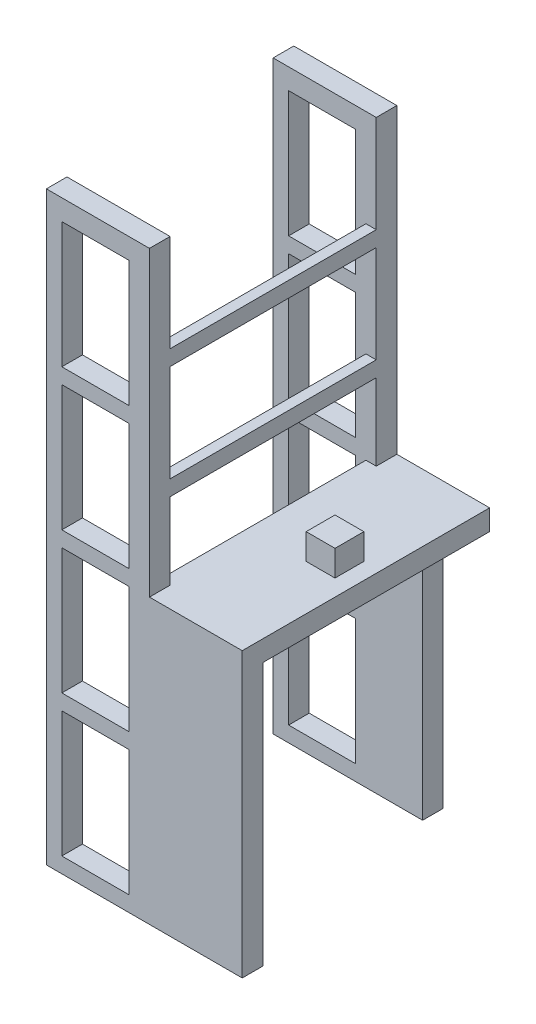
from build123d import *

# Parameters (mm, degrees)
SKETCH_1_W          = 2.8
SKETCH_1_H          = 2.8
EXTRUDE_1_DEPTH     = 4.5
SKETCH_2_W          = 9
SKETCH_2_H          = 24
EXTRUDE_2_DEPTH     = 2
SKETCH_3_W          = 24
SKETCH_3_H          = 31.3
EXTRUDE_3_DEPTH     = 1
SKETCH_3_3_W        = 20
SKETCH_3_3_H        = 7.433333333
SKETCH_3_3_H_2      = 9.433333334
SKETCH_3_3_H_3      = 9.433333333
CUT_EXTRUDE_1_DEPTH = 35.708644456
SKETCH_3_4_W        = 2
SKETCH_3_4_H        = 31.3
EXTRUDE_4_DEPTH     = 10
SKETCH_5_W          = 19
SKETCH_5_H          = 2
SKETCH_5_W_2        = 14.5
EXTRUDE_5_DEPTH     = 25.5
SKETCH_6_W          = 6.5
SKETCH_6_H          = 12.2
CUT_EXTRUDE_2_DEPTH = 43.563951884


with BuildPart() as part:
    # 草图1 → 凸台-拉伸1 (new body)
    with BuildSketch(Plane(origin=(0, 0, 0), x_dir=(1, 0, 0), z_dir=(0, 1, 0))):
        Rectangle(SKETCH_1_W, SKETCH_1_H)
    extrude(amount=EXTRUDE_1_DEPTH)

    # 草图2 → 凸台-拉伸2 (add)
    with BuildSketch(Plane.XZ):
        with Locations((-1.5, 0)):
            Rectangle(SKETCH_2_W, SKETCH_2_H)
    extrude(amount=-EXTRUDE_2_DEPTH)

    # 草图3 → 凸台-拉伸3 (add)
    with BuildSketch(Plane.ZY.offset(6)):
        with Locations((0, 15.65)):
            Rectangle(SKETCH_3_W, SKETCH_3_H)
    extrude(amount=EXTRUDE_3_DEPTH)

    # 草图3<3> → 切除-拉伸1 (cut, through all)
    with BuildSketch(Plane.ZY.offset(6)):
        with Locations((0, 5.716666667)):
            Rectangle(SKETCH_3_3_W, SKETCH_3_3_H)
        with Locations((0, 15.65)):
            Rectangle(SKETCH_3_3_W, SKETCH_3_3_H_2)
        with Locations((0, 26.583333334)):
            Rectangle(SKETCH_3_3_W, SKETCH_3_3_H_3)
    extrude(amount=CUT_EXTRUDE_1_DEPTH, mode=Mode.SUBTRACT)

    # 草图3<4> → 凸台-拉伸4 (add)
    with BuildSketch(Plane.ZY.offset(6)):
        with Locations((11, 15.65)):
            Rectangle(SKETCH_3_4_W, SKETCH_3_4_H)
        with Locations((-11, 15.65)):
            Rectangle(SKETCH_3_4_W, SKETCH_3_4_H)
    extrude(amount=EXTRUDE_4_DEPTH)

    # 草图5 → 凸台-拉伸5 (add)
    with BuildSketch(Plane.XZ):
        with Locations((-6.5, 11)):
            Rectangle(SKETCH_5_W, SKETCH_5_H)
        with Locations((-8.75, -11)):
            Rectangle(SKETCH_5_W_2, SKETCH_5_H)
    extrude(amount=EXTRUDE_5_DEPTH)

    # 草图6 → 切除-拉伸2 (cut, through all)
    with BuildSketch(Plane(origin=(0, 0, -12), x_dir=(-1, 0, 0), z_dir=(0, 0, -1))):
        with Locations((11.25, -17.9)):
            Rectangle(SKETCH_6_W, SKETCH_6_H)
        with Locations((11.25, -4.2)):
            Rectangle(SKETCH_6_W, SKETCH_6_H)
        with Locations((11.25, 9.5)):
            Rectangle(SKETCH_6_W, SKETCH_6_H)
        with Locations((11.25, 23.2)):
            Rectangle(SKETCH_6_W, SKETCH_6_H)
    extrude(amount=-CUT_EXTRUDE_2_DEPTH, mode=Mode.SUBTRACT)


solid = part.part
